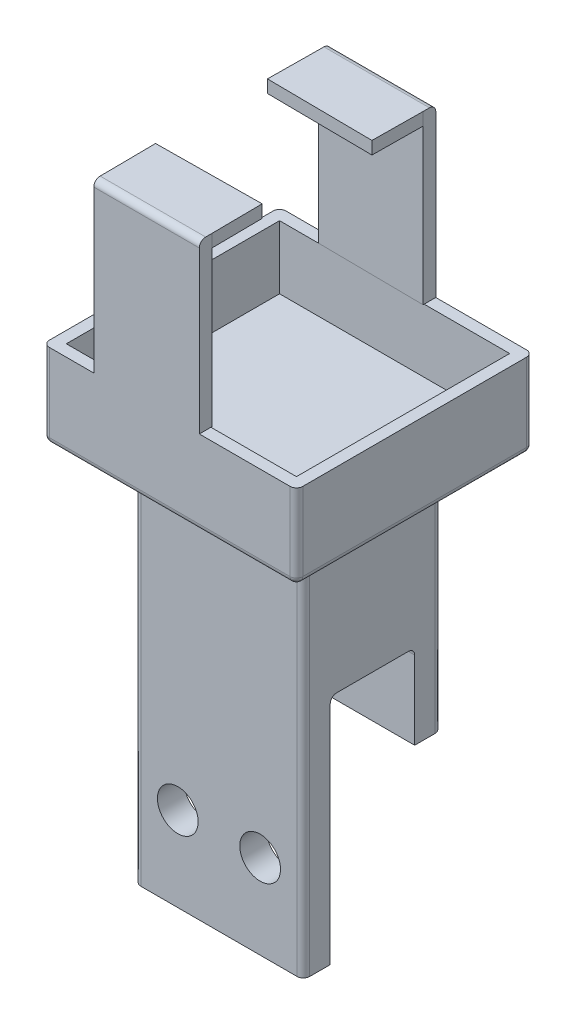
from build123d import *

# Parameters (mm, degrees)
BOSS_EXTRUDE1_DEPTH = 40
SKETCH2_R           = 4.826
CUT_EXTRUDE2_DEPTH  = 81.20668613
SKETCH6_W           = 40
SKETCH6_H           = 32.7
BOSS_EXTRUDE2_DEPTH = 30
BOSS_EXTRUDE3_START = 91.35
SKETCH7_W           = 60
SKETCH7_H           = 56
BOSS_EXTRUDE3_DEPTH = 20
SKETCH8_W           = 54.5
SKETCH8_H           = 50.5
CUT_EXTRUDE3_DEPTH  = 15
BOSS_EXTRUDE4_DEPTH = 39.65
SKETCH10_W          = 25.001249969
SKETCH10_H          = 3
BOSS_EXTRUDE5_DEPTH = 12
FILLET1_R           = 1.5
FILLET2_R           = 1.5
FILLET3_R           = 1.5


with BuildPart() as part:
    # Sketch1 → Boss-Extrude1 (new body)
    with BuildSketch(Plane(origin=(0, 0, 0), x_dir=(0, 0, -1), z_dir=(1, 0, 0))):
        with BuildLine():
            Line((-10, 0), (-10, 53.5))
            ThreePointArc((-10, 53.5), (-9.560660172, 54.560660172), (-8.5, 55))
            Line((-8.5, 55), (8.5, 55))
            ThreePointArc((8.5, 55), (9.560660172, 54.560660172), (10, 53.5))
            Line((10, 53.5), (10, 35))
            Line((10, 35), (16.35, 35))
            Line((16.35, 35), (16.35, 61.35))
            Line((16.35, 61.35), (-16.35, 61.35))
            Line((-16.35, 61.35), (-16.35, 0))
            Line((-16.35, 0), (-10, 0))
        make_face()
    extrude(amount=BOSS_EXTRUDE1_DEPTH)

    # Sketch2 → Cut-Extrude2 (cut, through all)
    with BuildSketch(Plane.XY.offset(16.35)):
        with Locations((10.25, 20)):
            Circle(SKETCH2_R)
        with Locations(Location((29.75, 20, 0), (0, 0, 270))):
            Circle(SKETCH2_R)
    extrude(amount=-CUT_EXTRUDE2_DEPTH, mode=Mode.SUBTRACT)

    # Sketch6 → Boss-Extrude2 (add)
    with BuildSketch(Plane(origin=(0, 61.35, 0), x_dir=(1, 0, 0), z_dir=(0, 1, 0))):
        with Locations((20, 0)):
            Rectangle(SKETCH6_W, SKETCH6_H)
    extrude(amount=BOSS_EXTRUDE2_DEPTH)

    # Sketch7 → Boss-Extrude3 (add)
    with BuildSketch(Plane(origin=(0, 0, 0), x_dir=(1, 0, 0), z_dir=(0, 1, 0)).offset(BOSS_EXTRUDE3_START)):
        with Locations((20, 0)):
            Rectangle(SKETCH7_W, SKETCH7_H)
    extrude(amount=BOSS_EXTRUDE3_DEPTH)

    # Sketch8 → Cut-Extrude3 (cut)
    with BuildSketch(Plane(origin=(0, 111.35, 0), x_dir=(1, 0, 0), z_dir=(0, 1, 0))):
        with Locations((20, 0)):
            Rectangle(SKETCH8_W, SKETCH8_H)
    extrude(amount=-CUT_EXTRUDE3_DEPTH, mode=Mode.SUBTRACT)

    # Sketch9 → Boss-Extrude4 (add)
    with BuildSketch(Plane(origin=(0, 111.35, 0), x_dir=(1, 0, 0), z_dir=(0, 1, 0))):
        Polygon((2, -25.25), (27, -25), (27, -28), (2, -28), align=None)
    boss_extrude4 = extrude(amount=BOSS_EXTRUDE4_DEPTH)

    # Sketch10 → Boss-Extrude5 (add)
    with BuildSketch(Plane(origin=(3.999900008, 0, 25.230001), x_dir=(0.9999500037496876, 0, -0.00999950003749703), z_dir=(0.00999950003749703, 0, 0.9999500037496877))):
        with Locations((10.500624984, 149.5)):
            Rectangle(SKETCH10_W, SKETCH10_H)
    boss_extrude5 = extrude(amount=-BOSS_EXTRUDE5_DEPTH)

    # Mirror1: Boss-Extrude4, Boss-Extrude5 across plane
    add(boss_extrude4.mirror(Plane.XY))
    add(boss_extrude5.mirror(Plane.XY))

    # Fillet1
    fillet1_edges = [part.edges().sort_by_distance(p)[0] for p in [
        (14.5, 151, -28),
        (14.5, 151, 28),
    ]]
    fillet(fillet1_edges, radius=FILLET1_R)

    # Fillet2
    fillet2_edges = [part.edges().sort_by_distance(p)[0] for p in [
        (0, 45.675, 16.35),
        (0, 63.175, -16.35),
        (40, 63.175, -16.35),
        (40, 45.675, 16.35),
        (50, 101.35, -28),
        (-10, 101.35, -28),
        (-10, 101.35, 28),
        (50, 101.35, 28),
    ]]
    fillet(fillet2_edges, radius=FILLET2_R)

    # Fillet3
    fillet3_edges = [part.edges().sort_by_distance(p)[0] for p in [
        (20, 91.35, 28),
        (20, 91.35, -28),
        (50, 91.35, 0),
        (-10, 91.35, 0),
        (49.560660172, 91.35, 27.560660172),
        (49.560660172, 91.35, -27.560660172),
        (-9.560660172, 91.35, -27.560660172),
        (-9.560660172, 91.35, 27.560660172),
    ]]
    fillet(fillet3_edges, radius=FILLET3_R)


solid = part.part
